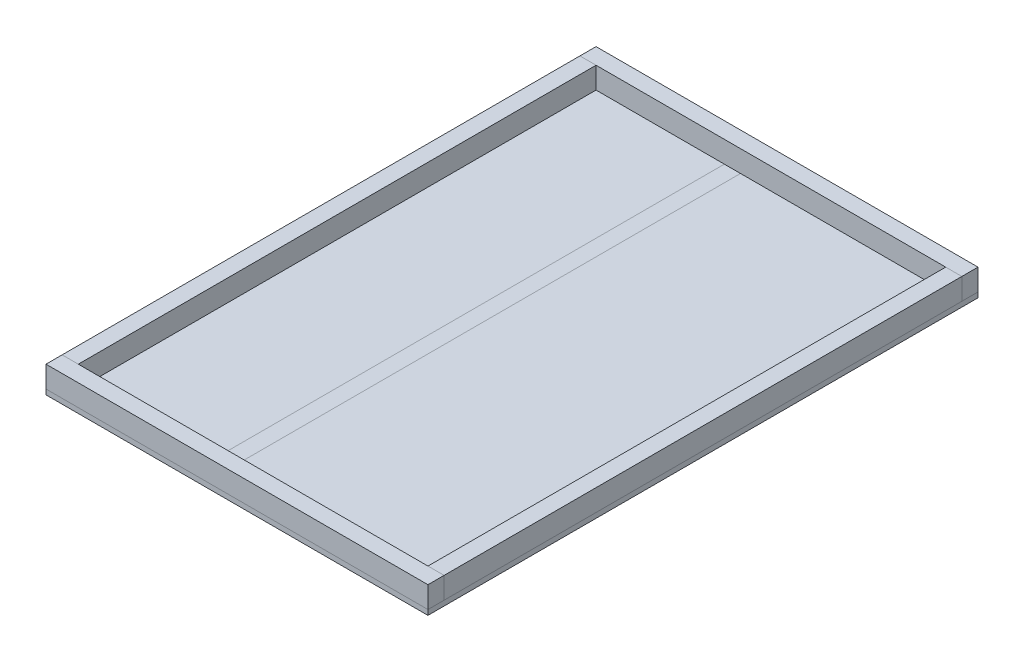
from build123d import *

# Parameters (mm, degrees)
SKETCH1_W             = 450.8
SKETCH1_H             = 649.2
BOSS_EXTRUDE1_DEPTH   = 6
SKETCH1_3_W           = 19.05
SKETCH1_3_H           = 611.1
BOSS_EXTRUDE2_DEPTH   = 25.4
BOSS_EXTRUDE2_2_DEPTH = 25.4
SKETCH1_4_W           = 450.8
SKETCH1_4_H           = 19.05
BOSS_EXTRUDE3_DEPTH   = 25.4
BOSS_EXTRUDE3_2_DEPTH = 25.4
SKETCH4_W             = 50.8
SKETCH4_H             = 611.1
BOSS_EXTRUDE5_DEPTH   = 19.05
SKETCH2_W             = 19.05
SKETCH2_H             = 611.1
CUT_EXTRUDE1_DEPTH    = 9.525
SKETCH2_2_W           = 19.05
SKETCH2_2_H           = 611.1
BOSS_EXTRUDE4_DEPTH   = 9.525


with BuildPart() as part:
    # Sketch1 → Boss-Extrude1 (new body)
    with BuildSketch(Plane(origin=(0, 0, 0), x_dir=(1, 0, 0), z_dir=(0, 1, 0))):
        Rectangle(SKETCH1_W, SKETCH1_H)
    extrude(amount=-BOSS_EXTRUDE1_DEPTH)

    # Sketch4 → Boss-Extrude5 (add)
    with BuildSketch(Plane.XZ.offset(6)):
        with Locations((-45.4, 0)):
            Rectangle(SKETCH4_W, SKETCH4_H)
    extrude(amount=BOSS_EXTRUDE5_DEPTH)

    # Sketch2 → Cut-Extrude1 (cut)
    with BuildSketch(Plane(origin=(0, 0, 0), x_dir=(1, 0, 0), z_dir=(0, 1, 0))):
        with Locations((-45.4, 0)):
            Rectangle(SKETCH2_W, SKETCH2_H)
    extrude(amount=-CUT_EXTRUDE1_DEPTH, mode=Mode.SUBTRACT)


with BuildPart() as body_2:
    # Sketch1<3> → Boss-Extrude2 (new body)
    with BuildSketch(Plane(origin=(0, 0, 0), x_dir=(1, 0, 0), z_dir=(0, 1, 0))):
        with Locations((215.875, 0)):
            Rectangle(SKETCH1_3_W, SKETCH1_3_H)
    extrude(amount=BOSS_EXTRUDE2_DEPTH)


with BuildPart() as body_3:
    # Sketch1<3> → Boss-Extrude2 2 (new body)
    with BuildSketch(Plane(origin=(0, 0, 0), x_dir=(1, 0, 0), z_dir=(0, 1, 0))):
        with Locations((-215.875, 0)):
            Rectangle(SKETCH1_3_W, SKETCH1_3_H)
    extrude(amount=BOSS_EXTRUDE2_2_DEPTH)


with BuildPart() as body_4:
    # Sketch1<4> → Boss-Extrude3 (new body)
    with BuildSketch(Plane(origin=(0, 0, 0), x_dir=(1, 0, 0), z_dir=(0, 1, 0))):
        with Locations((0, 315.075)):
            Rectangle(SKETCH1_4_W, SKETCH1_4_H)
    extrude(amount=BOSS_EXTRUDE3_DEPTH)


with BuildPart() as body_5:
    # Sketch1<4> → Boss-Extrude3 2 (new body)
    with BuildSketch(Plane(origin=(0, 0, 0), x_dir=(1, 0, 0), z_dir=(0, 1, 0))):
        with Locations((0, -315.075)):
            Rectangle(SKETCH1_4_W, SKETCH1_4_H)
    extrude(amount=BOSS_EXTRUDE3_2_DEPTH)


with BuildPart() as body_6:
    # Sketch2<2> → Boss-Extrude4 (new body)
    with BuildSketch(Plane(origin=(0, 0, 0), x_dir=(1, 0, 0), z_dir=(0, 1, 0))):
        with Locations((-45.4, 0)):
            Rectangle(SKETCH2_2_W, SKETCH2_2_H)
    extrude(amount=-BOSS_EXTRUDE4_DEPTH)


solid = Compound([part.part, body_2.part, body_3.part, body_4.part, body_5.part, body_6.part])
